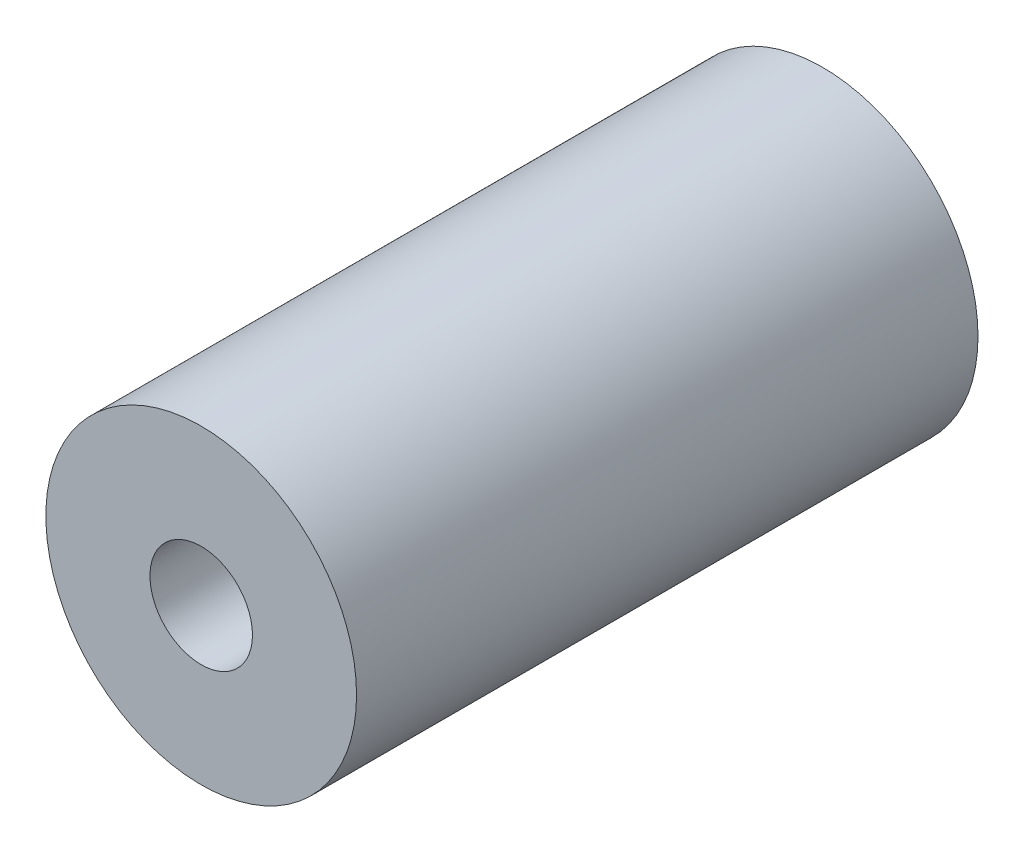
from build123d import *

# Parameters (mm, degrees)
SKETCH_1_R      = 50
SKETCH_1_R_2    = 16.5
EXTRUDE_1_DEPTH = 200


with BuildPart() as part:
    # 草图1 → 凸台-拉伸1 (new body)
    with BuildSketch(Plane.XY):
        Circle(SKETCH_1_R)
        Circle(SKETCH_1_R_2, mode=Mode.SUBTRACT)
    extrude(amount=EXTRUDE_1_DEPTH)


solid = part.part
